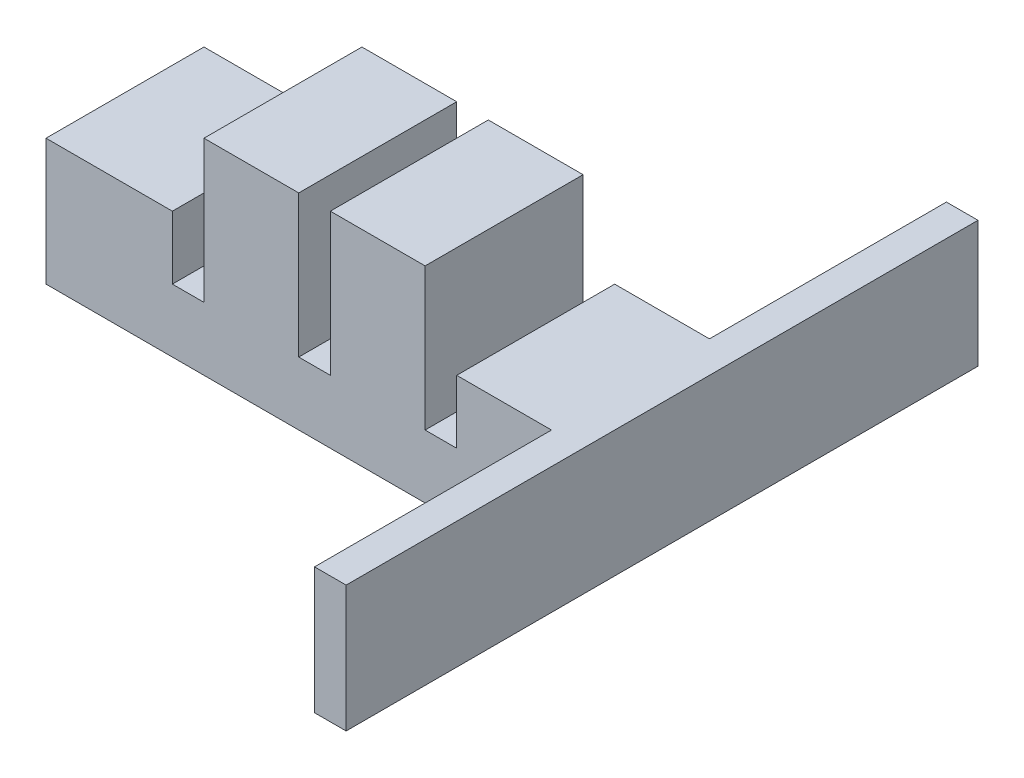
from build123d import *

# Parameters (mm, degrees)
SKETCH1_W           = 6
SKETCH1_H           = 10
BOSS_EXTRUDE1_DEPTH = 13
SKETCH2_W           = 4
SKETCH2_H           = 6
CUT_EXTRUDE1_DEPTH  = 11
SKETCH3_W           = 10
SKETCH3_H           = 4
BOSS_EXTRUDE2_DEPTH = 2
LPATTERN1_COUNT     = 2
LPATTERN1_PITCH     = 8
SKETCH18_W          = 10
SKETCH18_H          = 8
BOSS_EXTRUDE3_DEPTH = 8
SKETCH20_W          = 10
SKETCH20_H          = 4
BOSS_EXTRUDE4_DEPTH = 2
SKETCH21_W          = 10
SKETCH21_H          = 8
BOSS_EXTRUDE5_DEPTH = 6
SKETCH22_W          = 40
SKETCH22_H          = 8
BOSS_EXTRUDE6_DEPTH = 2
SKETCH23_W          = 4
SKETCH23_H          = 6
CUT_EXTRUDE2_DEPTH  = 6


with BuildPart() as part:
    # Sketch1 → Boss-Extrude1 (new body)
    with BuildSketch(Plane(origin=(0, 0, 0), x_dir=(1, 0, 0), z_dir=(0, 1, 0))):
        with Locations((3, 5)):
            Rectangle(SKETCH1_W, SKETCH1_H)
    extrude(amount=BOSS_EXTRUDE1_DEPTH)

    # Sketch2 → Cut-Extrude1 (cut)
    with BuildSketch(Plane.XZ):
        with Locations((3, -5)):
            Rectangle(SKETCH2_W, SKETCH2_H)
    extrude(amount=-CUT_EXTRUDE1_DEPTH, mode=Mode.SUBTRACT)

    # Sketch3 → Boss-Extrude2 (add)
    with BuildSketch(Plane.ZY):
        with Locations((-5, 2)):
            Rectangle(SKETCH3_W, SKETCH3_H)
    extrude(amount=BOSS_EXTRUDE2_DEPTH)


with BuildPart() as lpattern1_1:
    # LPattern1: pattern copy
    add(part.part.moved(Location(Vector(-1, 0, 0) * (1 * LPATTERN1_PITCH))))

    # Sketch18 → Boss-Extrude3 (add)
    with BuildSketch(Plane.ZY.offset(10)):
        with Locations((-5, 4)):
            Rectangle(SKETCH18_W, SKETCH18_H)
    extrude(amount=BOSS_EXTRUDE3_DEPTH)


with BuildPart() as part_1:
    add(part.part)

    # Sketch20 → Boss-Extrude4 (add)
    with BuildSketch(Plane(origin=(6, 0, 0), x_dir=(0, 0, -1), z_dir=(1, 0, 0))):
        with Locations((5, 2)):
            Rectangle(SKETCH20_W, SKETCH20_H)
    extrude(amount=BOSS_EXTRUDE4_DEPTH)

    # Sketch21 → Boss-Extrude5 (add)
    with BuildSketch(Plane(origin=(8, 0, 0), x_dir=(0, 0, -1), z_dir=(1, 0, 0))):
        with Locations((5, 4)):
            Rectangle(SKETCH21_W, SKETCH21_H)
    extrude(amount=BOSS_EXTRUDE5_DEPTH)

    # Sketch22 → Boss-Extrude6 (add)
    with BuildSketch(Plane(origin=(14, 0, 0), x_dir=(0, 0, -1), z_dir=(1, 0, 0))):
        with Locations((5, 4)):
            Rectangle(SKETCH22_W, SKETCH22_H)
    extrude(amount=BOSS_EXTRUDE6_DEPTH)


with BuildPart() as cut_extrude2_tool:
    # Sketch23 → Cut-Extrude2 (new body)
    with BuildSketch(Plane.XZ):
        with Locations((11, -5)):
            Rectangle(SKETCH23_W, SKETCH23_H)
        with Locations((-13, -5)):
            Rectangle(SKETCH23_W, SKETCH23_H)
    extrude(amount=-CUT_EXTRUDE2_DEPTH)


with BuildPart() as part_2:
    add(part_1.part)

    # Cut-Extrude2: cut by cut_extrude2_tool
    add(cut_extrude2_tool.part, mode=Mode.SUBTRACT)


with BuildPart() as lpattern1_1_1:
    add(lpattern1_1.part)

    # Cut-Extrude2: cut by cut_extrude2_tool
    add(cut_extrude2_tool.part, mode=Mode.SUBTRACT)

    # Combine1: union part
    add(part_2.part)


solid = lpattern1_1_1.part
